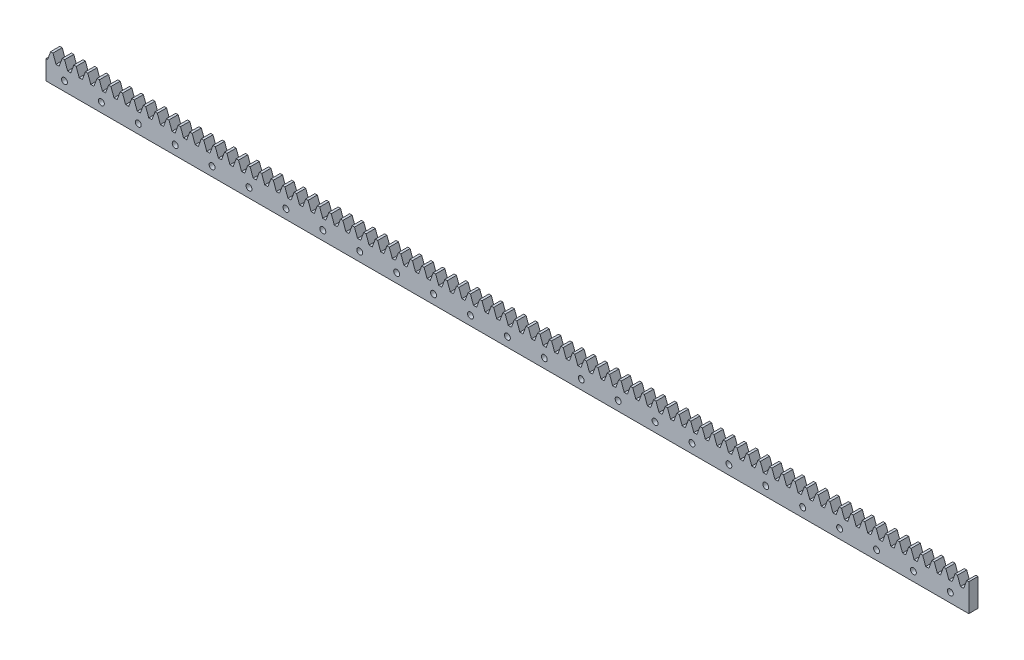
from build123d import *

# Parameters (mm, degrees)
BLANKSKE_W          = 500
BLANKSKE_H          = 12
BLANK_DEPTH         = 5
TOOTHCUTSIM_DEPTH   = 501.168971449
TEETHCUTS_COUNT     = 80
TEETHCUTS_PITCH     = 6.2831853
SKETCH_2_W          = 500
SKETCH_2_H          = 3
EXTRUDE_2_DEPTH     = 5
SKETCH_3_R          = 1.6
CUT_EXTRUDE_1_DEPTH = 501.168971449


with BuildPart() as part:
    # BlankSke → Blank (new body)
    with BuildSketch(Plane.XY):
        with Locations((250, 6)):
            Rectangle(BLANKSKE_W, BLANKSKE_H)
    extrude(amount=-BLANK_DEPTH)

    # TooCutSkeSim → ToothCutSim (cut, through all)
    with BuildSketch(Plane.XY):
        Polygon((0.861870739, 7.5), (-0.861870739, 7.5), (-2.508981637, 12.0254), (2.508981637, 12.0254), align=None)
    toothcutsim = extrude(amount=-TOOTHCUTSIM_DEPTH, mode=Mode.SUBTRACT)

    # TeethCuts: ToothCutSim ×80
    with Locations(*[(i * TEETHCUTS_PITCH, 0, 0) for i in range(1, TEETHCUTS_COUNT)]):
        add(toothcutsim, mode=Mode.SUBTRACT)

    # 草图2 → 凸台-拉伸2 (add)
    with BuildSketch(Plane.XY):
        with Locations((250, -1.5)):
            Rectangle(SKETCH_2_W, SKETCH_2_H)
    extrude(amount=-EXTRUDE_2_DEPTH)

    # 草图3 → 切除-拉伸1 (cut, through all)
    with BuildSketch(Plane(origin=(0, 0, -5), x_dir=(-1, 0, 0), z_dir=(0, 0, -1))):
        with Locations((-490, 2)):
            Circle(SKETCH_3_R)
        with Locations((-470, 2)):
            Circle(SKETCH_3_R)
        with Locations((-450, 2)):
            Circle(SKETCH_3_R)
        with Locations((-430, 2)):
            Circle(SKETCH_3_R)
        with Locations((-410, 2)):
            Circle(SKETCH_3_R)
        with Locations((-390, 2)):
            Circle(SKETCH_3_R)
        with Locations((-370, 2)):
            Circle(SKETCH_3_R)
        with Locations((-350, 2)):
            Circle(SKETCH_3_R)
        with Locations((-330, 2)):
            Circle(SKETCH_3_R)
        with Locations((-310, 2)):
            Circle(SKETCH_3_R)
        with Locations((-290, 2)):
            Circle(SKETCH_3_R)
        with Locations((-270, 2)):
            Circle(SKETCH_3_R)
        with Locations((-250, 2)):
            Circle(SKETCH_3_R)
        with Locations((-230, 2)):
            Circle(SKETCH_3_R)
        with Locations((-210, 2)):
            Circle(SKETCH_3_R)
        with Locations((-190, 2)):
            Circle(SKETCH_3_R)
        with Locations((-170, 2)):
            Circle(SKETCH_3_R)
        with Locations((-150, 2)):
            Circle(SKETCH_3_R)
        with Locations((-130, 2)):
            Circle(SKETCH_3_R)
        with Locations((-110, 2)):
            Circle(SKETCH_3_R)
        with Locations((-90, 2)):
            Circle(SKETCH_3_R)
        with Locations((-70, 2)):
            Circle(SKETCH_3_R)
        with Locations((-50, 2)):
            Circle(SKETCH_3_R)
        with Locations((-30, 2)):
            Circle(SKETCH_3_R)
        with Locations((-10, 2)):
            Circle(SKETCH_3_R)
    extrude(amount=-CUT_EXTRUDE_1_DEPTH, mode=Mode.SUBTRACT)


solid = part.part
